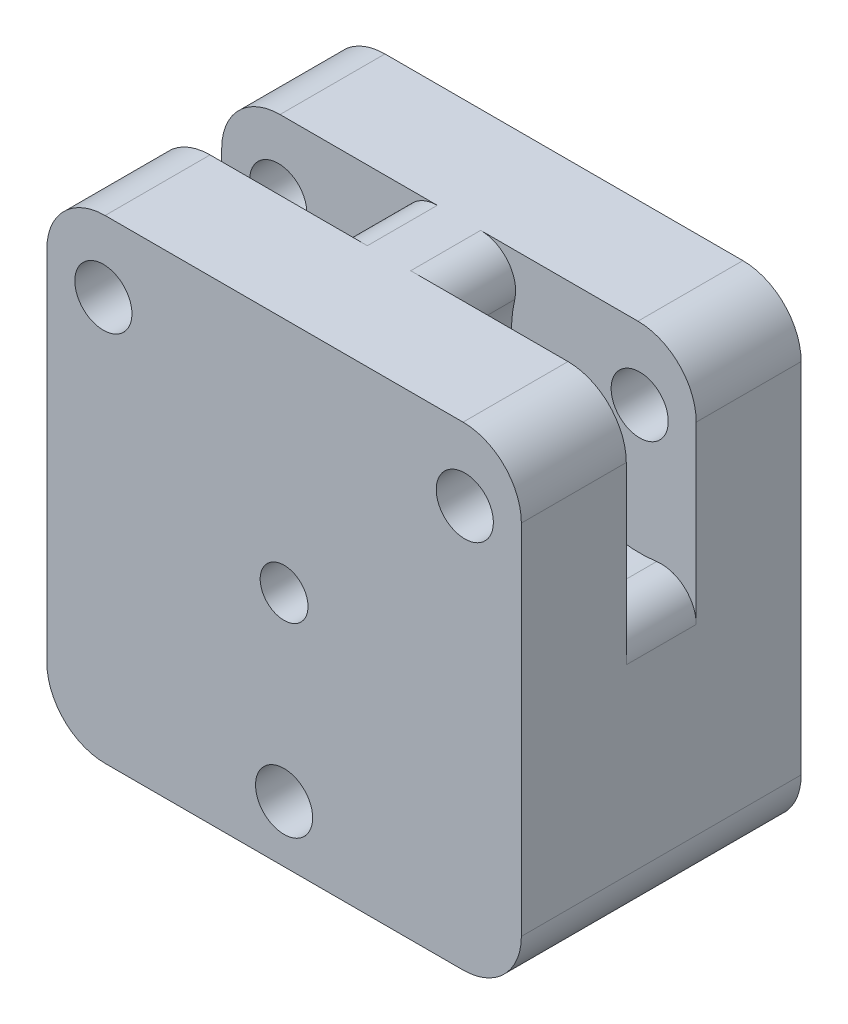
from build123d import *

# Parameters (mm, degrees)
SKETCH1_R           = 2.05
BOSS_EXTRUDE1_DEPTH = 24
CUT_EXTRUDE1_START  = 15
SKETCH1_4_R         = 11
CUT_EXTRUDE1_DEPTH  = 6
SKETCH1_5_R         = 2.45
CUT_EXTRUDE3_DEPTH  = 44
FILLET1_R           = 3


with BuildPart() as part:
    # Sketch1 → Boss-Extrude1 (new body)
    with BuildSketch(Plane.XY):
        with BuildLine():
            ThreePointArc((-20.35, -15.35), (-18.885533906, -18.885533906), (-15.35, -20.35))
            Line((-15.35, -20.35), (15.35, -20.35))
            ThreePointArc((15.35, -20.35), (18.885533906, -18.885533906), (20.35, -15.35))
            Line((20.35, -15.35), (20.35, 15.35))
            ThreePointArc((20.35, 15.35), (18.885533906, 18.885533906), (15.35, 20.35))
            Line((15.35, 20.35), (-15.35, 20.35))
            ThreePointArc((-15.35, 20.35), (-18.885533906, 18.885533906), (-20.35, 15.35))
            Line((-20.35, 15.35), (-20.35, -15.35))
        make_face()
        Circle(SKETCH1_R, mode=Mode.SUBTRACT)
    extrude(amount=BOSS_EXTRUDE1_DEPTH)

    # Sketch1<4> → Cut-Extrude1 (cut)
    with BuildSketch(Plane.XY.offset(CUT_EXTRUDE1_START)):
        with Locations((0, -15.5)):
            Circle(SKETCH1_4_R)
        with Locations((-15.5, 14.200476627)):
            Circle(SKETCH1_4_R)
        with Locations((15.5, 14.200476627)):
            Circle(SKETCH1_4_R)
    extrude(amount=-CUT_EXTRUDE1_DEPTH, mode=Mode.SUBTRACT)

    # Sketch1<5> → Cut-Extrude3 (cut)
    with BuildSketch(Plane.XY):
        with Locations((-15.5, 14.200476627)):
            Circle(SKETCH1_5_R)
        with Locations((15.5, 14.200476627)):
            Circle(SKETCH1_5_R)
        with Locations((0, -15.5)):
            Circle(SKETCH1_5_R)
    extrude(amount=CUT_EXTRUDE3_DEPTH, mode=Mode.SUBTRACT)

    # Fillet1
    fillet1_edges = [part.edges().sort_by_distance(p)[0] for p in [
        (-9.873069432, -20.35, 12),
        (9.873069432, -20.35, 12),
        (-20.35, 4.327407195, 12),
        (20.35, 4.327407195, 12),
        (-6.37950866, 20.35, 12),
        (6.37950866, 20.35, 12),
    ]]
    fillet(fillet1_edges, radius=FILLET1_R)


solid = part.part
